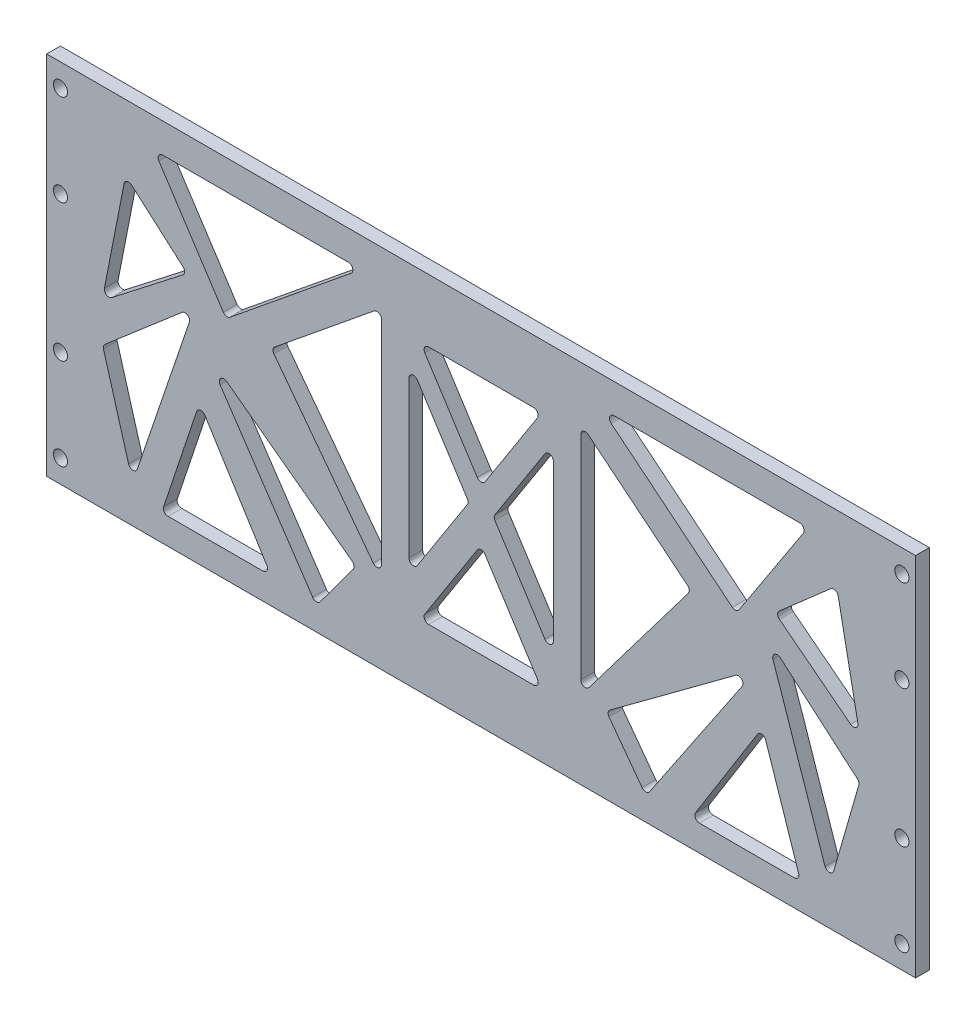
from build123d import *

# Parameters (mm, degrees)
SKETCH_1_W             = 190
SKETCH_1_H             = 80
EXTRUDE_1_DEPTH        = 3
SKETCH_2_R             = 1.55
CUT_EXTRUDE_1_DEPTH    = 3
CUT_EXTRUDE_3_DEPTH    = 3
FILLET_1_R             = 1
CUT_EXTRUDE_4_DEPTH    = 3
FILLET_2_R             = 1
FILLET_2_OF_MIRROR_2_R = 1


with BuildPart() as part:
    # 草图1 → 凸台-拉伸1 (new body)
    with BuildSketch(Plane.XY):
        Rectangle(SKETCH_1_W, SKETCH_1_H)
    extrude(amount=EXTRUDE_1_DEPTH)

    # 草图2 → 切除-拉伸1 (cut)
    with BuildSketch(Plane.XY.offset(3)):
        with Locations((-92, 35)):
            Circle(SKETCH_2_R)
        with Locations((-92, 15)):
            Circle(SKETCH_2_R)
        with Locations((-92, -15)):
            Circle(SKETCH_2_R)
        with Locations((-92, -35)):
            Circle(SKETCH_2_R)
    cut_extrude_1 = extrude(amount=-CUT_EXTRUDE_1_DEPTH, mode=Mode.SUBTRACT)

    # 镜向1: 切除-拉伸1 across plane
    add(cut_extrude_1.mirror(Plane(origin=(0, 0, 0), x_dir=(0, 0, 1), z_dir=(1, 0, 0))), mode=Mode.SUBTRACT)

    # 草图3 → 切除-拉伸3 (cut)
    with BuildSketch(Plane.XY.offset(3)):
        Polygon((-13.305143171, 26.275790798), (13.305143171, 26.275790798), (0, 5.552735947), align=None)
        Polygon((-15.79638841, 21.645852354), (-15.79638841, -19.238624417), (-2.671542174, 1.203613969), align=None)
        Polygon((13.305143171, -26.275790798), (0, -5.552735947), (-13.305143171, -26.275790798), align=None)
        Polygon((15.79638841, -19.238624417), (2.671542174, 1.203613969), (15.79638841, 21.645852354), align=None)
    extrude(amount=-CUT_EXTRUDE_3_DEPTH, mode=Mode.SUBTRACT)

    # 圆角1
    fillet_1_edges = [part.edges().sort_by_distance(p)[0] for p in [
        (13.305143171, -26.275790798, 1.5),
        (-13.305143171, -26.275790798, 1.5),
        (0, -5.552735947, 1.5),
        (-2.671542174, 1.203613969, 1.5),
        (-15.79638841, -19.238624417, 1.5),
        (-15.79638841, 21.645852354, 1.5),
        (15.79638841, 21.645852354, 1.5),
        (15.79638841, -19.238624417, 1.5),
        (2.671542174, 1.203613969, 1.5),
        (13.305143171, 26.275790798, 1.5),
        (0, 5.552735947, 1.5),
        (-13.305143171, 26.275790798, 1.5),
    ]]
    fillet(fillet_1_edges, radius=FILLET_1_R)

    # 草图4 → 切除-拉伸4 (cut)
    with BuildSketch(Plane.XY.offset(3)):
        Polygon((-77.745738902, 25.594620463), (-82.902270236, -0.687055367), (-64.272221547, 13.784500311), align=None)
        Polygon((-71.475542855, 33.528301912), (-26.245515021, 33.528301912), (-55.781663642, 9.474131903), align=None)
        Polygon((-62.637752989, 8.237432243), (-82.764859163, -9.061898683), (-76.217552598, -31.75354211), align=None)
        Polygon((-60.323461226, 1.113752911), (-27.372440787, -23.273725493), (-36.037862042, -34.981966425), align=None)
        Polygon((-61.552928725, -9.321130873), (-69.867515307, -34.294911058), (-45.916995004, -34.294911058), align=None)
        Polygon((-45.897652866, 8.806482477), (-21.784762082, 28.44396405), (-21.784762082, -23.085233425), align=None)
    cut_extrude_4 = extrude(amount=-CUT_EXTRUDE_4_DEPTH, mode=Mode.SUBTRACT)

    # 圆角2
    fillet_2_edges = [part.edges().sort_by_distance(p)[0] for p in [
        (-36.037862042, -34.981966425, 1.5),
        (-60.323461226, 1.113752911, 1.5),
        (-27.372440787, -23.273725493, 1.5),
        (-61.552928725, -9.321130873, 1.5),
        (-45.916995004, -34.294911058, 1.5),
        (-69.867515307, -34.294911058, 1.5),
        (-62.637752989, 8.237432243, 1.5),
        (-76.217552598, -31.75354211, 1.5),
        (-82.764859163, -9.061898683, 1.5),
        (-55.781663642, 9.474131903, 1.5),
        (-71.475542855, 33.528301912, 1.5),
        (-26.245515021, 33.528301912, 1.5),
        (-21.784762082, -23.085233425, 1.5),
        (-45.897652866, 8.806482477, 1.5),
        (-21.784762082, 28.44396405, 1.5),
        (-77.745738902, 25.594620463, 1.5),
        (-64.272221547, 13.784500311, 1.5),
        (-82.902270236, -0.687055367, 1.5),
    ]]
    fillet(fillet_2_edges, radius=FILLET_2_R)

    # 镜向2: 切除-拉伸4 across plane
    add(cut_extrude_4.mirror(Plane(origin=(0, 0, 0), x_dir=(0, 0, 1), z_dir=(1, 0, 0))), mode=Mode.SUBTRACT)

    # 圆角2 of 镜向2
    fillet_2_of_mirror_2_edges = [part.edges().sort_by_distance(p)[0] for p in [
        (36.037862042, -34.981966425, 1.5),
        (60.323461226, 1.113752911, 1.5),
        (27.372440787, -23.273725493, 1.5),
        (61.552928725, -9.321130873, 1.5),
        (45.916995004, -34.294911058, 1.5),
        (69.867515307, -34.294911058, 1.5),
        (62.637752989, 8.237432243, 1.5),
        (76.217552598, -31.75354211, 1.5),
        (82.764859163, -9.061898683, 1.5),
        (55.781663642, 9.474131903, 1.5),
        (71.475542855, 33.528301912, 1.5),
        (26.245515021, 33.528301912, 1.5),
        (21.784762082, -23.085233425, 1.5),
        (45.897652866, 8.806482477, 1.5),
        (21.784762082, 28.44396405, 1.5),
        (77.745738902, 25.594620463, 1.5),
        (64.272221547, 13.784500311, 1.5),
        (82.902270236, -0.687055367, 1.5),
    ]]
    fillet(fillet_2_of_mirror_2_edges, radius=FILLET_2_OF_MIRROR_2_R)


solid = part.part
